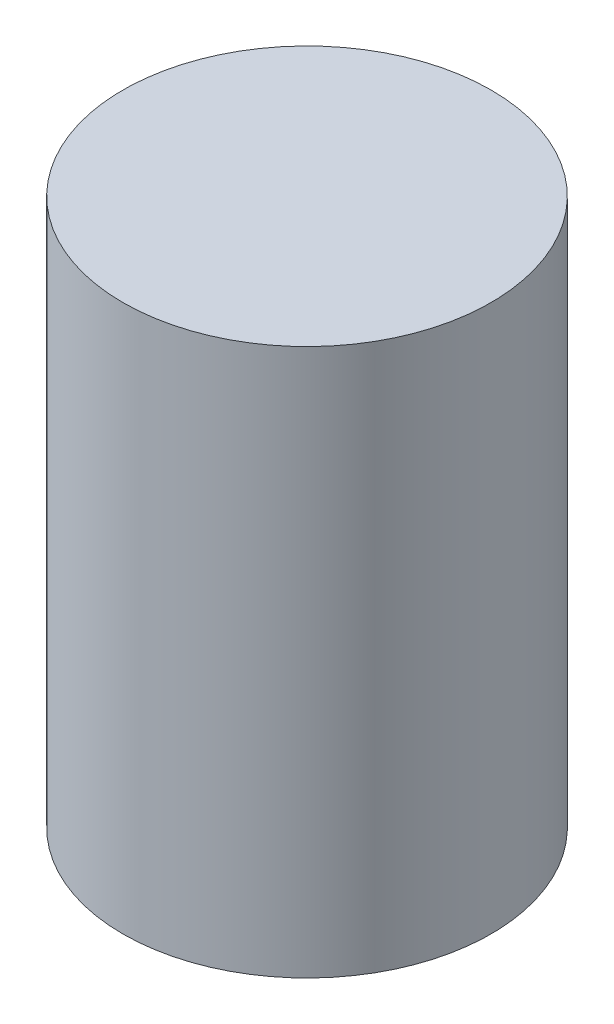
from build123d import *

# Parameters (mm, degrees)
SKETCH1_R           = 6.8
BOSS_EXTRUDE1_DEPTH = 20.2


with BuildPart() as part:
    # Sketch1 → Boss-Extrude1 (new body)
    with BuildSketch(Plane(origin=(0, 0, 0), x_dir=(1, 0, 0), z_dir=(0, 1, 0))):
        with Locations(Location((0, 0, 0), (0, 0, 270))):
            Circle(SKETCH1_R)
    extrude(amount=BOSS_EXTRUDE1_DEPTH)


solid = part.part
